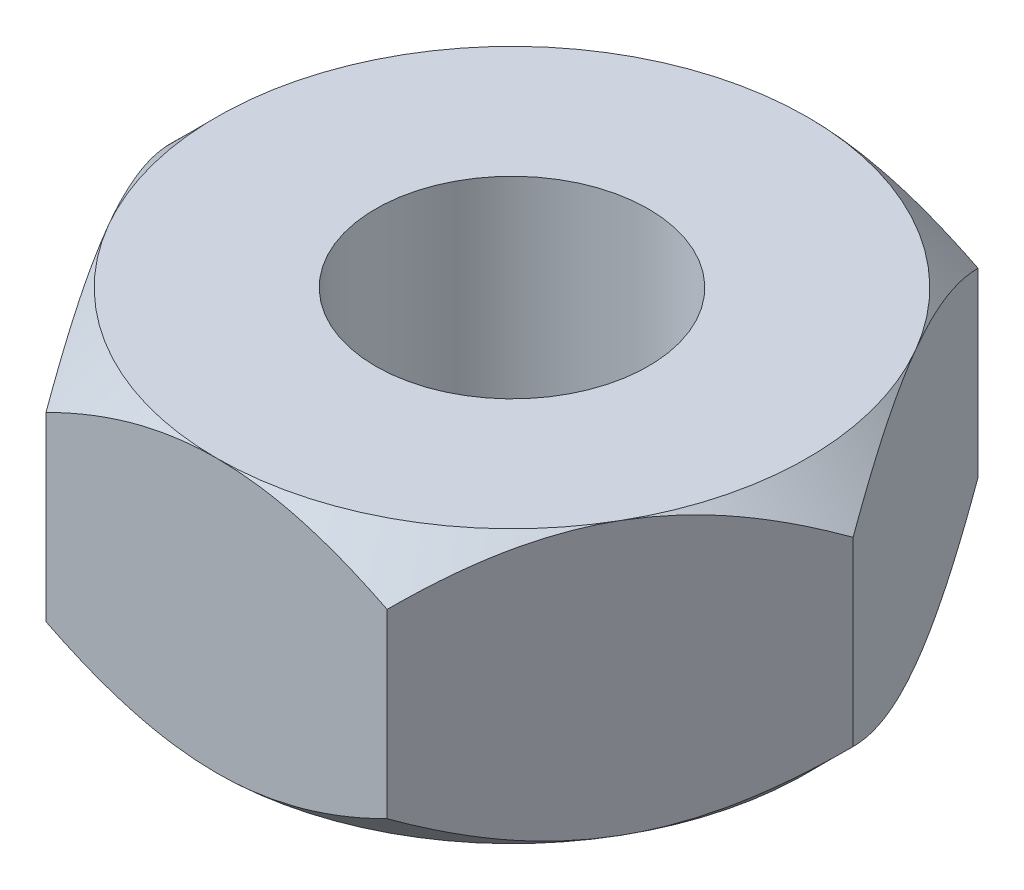
from build123d import *

# Parameters (mm, degrees)
BOSS_EXTRUDE1_DEPTH = 12
SKETCH3_R           = 6
CUT_EXTRUDE1_DEPTH  = 24.202011407
SKETCH6_OUTSIDE_W   = 88.724
SKETCH6_OUTSIDE_H   = 84.702
SKETCH6_OUTSIDE_R   = 13
CUT_EXTRUDE3_DEPTH  = 24.202011407
CUT_EXTRUDE3_DRAFT  = -45
SKETCH7_OUTSIDE_W   = 88.724
SKETCH7_OUTSIDE_H   = 84.702
SKETCH7_OUTSIDE_R   = 13
CUT_EXTRUDE4_DEPTH  = 24.202011407
CUT_EXTRUDE4_DRAFT  = -45


with BuildPart() as part:
    # Sketch2 → Boss-Extrude1 (new body)
    with BuildSketch(Plane(origin=(0, 0, 0), x_dir=(1, 0, 0), z_dir=(0, 1, 0))):
        Polygon((-15.011106999, 0), (-7.505553499, -13), (7.505553499, -13), (15.011106999, 0), (7.505553499, 13), (-7.505553499, 13), align=None)
    extrude(amount=BOSS_EXTRUDE1_DEPTH)

    # Sketch3 → Cut-Extrude1 (cut, through all)
    with BuildSketch(Plane(origin=(0, 12, 0), x_dir=(1, 0, 0), z_dir=(0, 1, 0))):
        with Locations(Location((0, 0, 0), (0, 0, 270))):
            Circle(SKETCH3_R)
    extrude(amount=-CUT_EXTRUDE1_DEPTH, mode=Mode.SUBTRACT)


with BuildPart() as cut_extrude3_tool:
    # Sketch6 outside → Cut-Extrude3 (with draft: the straight prism first)
    with BuildSketch(Plane(origin=(0, 12, 0), x_dir=(1, 0, 0), z_dir=(0, 1, 0))):
        Rectangle(SKETCH6_OUTSIDE_W, SKETCH6_OUTSIDE_H)
        Circle(SKETCH6_OUTSIDE_R, mode=Mode.SUBTRACT)
    extrude(amount=-CUT_EXTRUDE3_DEPTH)
    # Cut-Extrude3: the draft: its side faces are tilted about the plane it starts from
    cut_extrude3_sides = [cut_extrude3_tool.faces().sort_by_distance(p)[0] for p in [
        (0, -0.101005704, 42.351),
        (44.362, -0.101005704, 0),
        (0, -0.101005704, -42.351),
        (-44.362, -0.101005704, 0),
        (-13, -0.101005704, 0),
    ]]
    draft(cut_extrude3_sides, Plane(origin=(0, 12, 0), x_dir=(1, 0, 0), z_dir=(0, 1, 0)), CUT_EXTRUDE3_DRAFT)


with BuildPart() as part_1:
    add(part.part)

    # Cut-Extrude3: cut by cut_extrude3_tool
    add(cut_extrude3_tool.part, mode=Mode.SUBTRACT)


with BuildPart() as cut_extrude4_tool:
    # Sketch7 outside → Cut-Extrude4 (with draft: the straight prism first)
    with BuildSketch(Plane.XZ):
        Rectangle(SKETCH7_OUTSIDE_W, SKETCH7_OUTSIDE_H)
        Circle(SKETCH7_OUTSIDE_R, mode=Mode.SUBTRACT)
    extrude(amount=-CUT_EXTRUDE4_DEPTH)
    # Cut-Extrude4: the draft: its side faces are tilted about the plane it starts from
    cut_extrude4_sides = [cut_extrude4_tool.faces().sort_by_distance(p)[0] for p in [
        (0, 12.101005704, -42.351),
        (44.362, 12.101005704, 0),
        (0, 12.101005704, 42.351),
        (-44.362, 12.101005704, 0),
        (-13, 12.101005704, 0),
    ]]
    draft(cut_extrude4_sides, Plane.XZ, CUT_EXTRUDE4_DRAFT)


with BuildPart() as part_2:
    add(part_1.part)

    # Cut-Extrude4: cut by cut_extrude4_tool
    add(cut_extrude4_tool.part, mode=Mode.SUBTRACT)


solid = part_2.part
